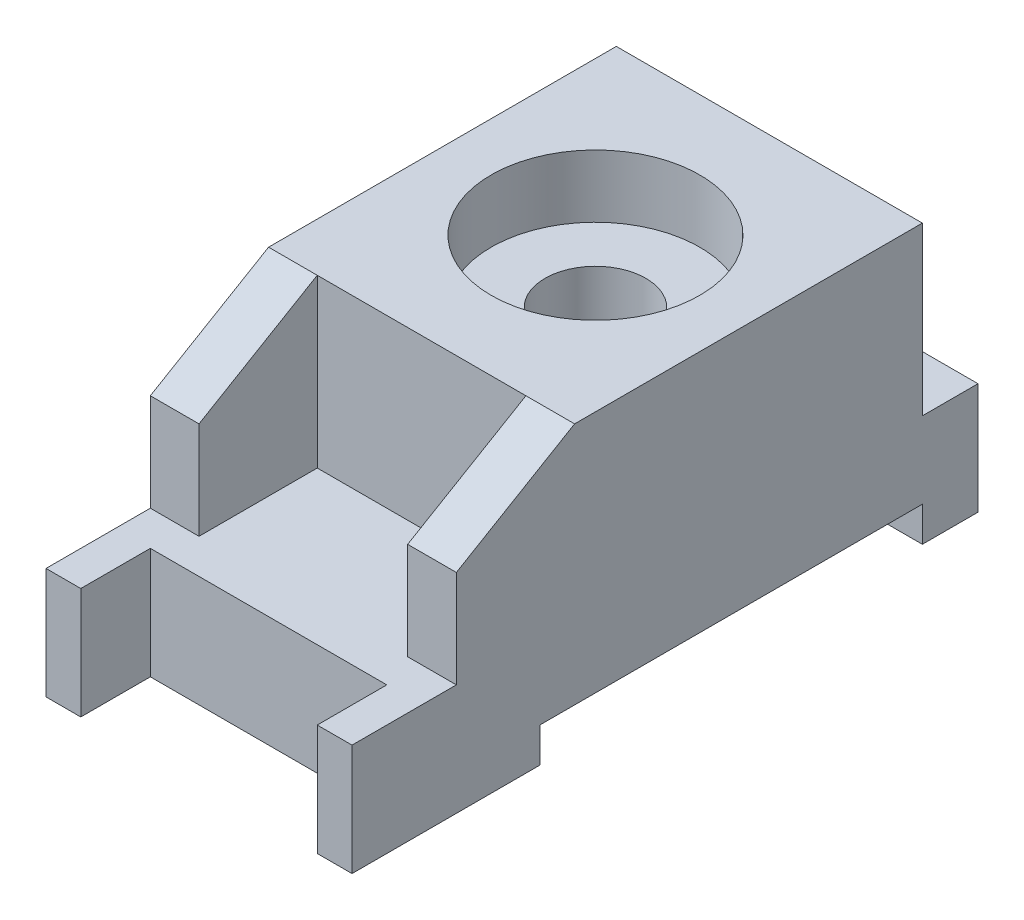
from build123d import *

# Parameters (mm, degrees)
SKETCH_1_W          = 44
SKETCH_1_H          = 16
EXTRUDE_1_DEPTH     = 90
SKETCH_2_W          = 55
SKETCH_2_H          = 5
CUT_EXTRUDE_1_DEPTH = 101.498756211
SKETCH_3_W          = 34
SKETCH_3_H          = 10
CUT_EXTRUDE_2_DEPTH = 95.021274188
SKETCH_4_W          = 44
SKETCH_4_H          = 67
EXTRUDE_2_DEPTH     = 24
SKETCH_5_W          = 30
SKETCH_5_H          = 17
CUT_EXTRUDE_3_DEPTH = 24
CUT_EXTRUDE_4_DEPTH = 106.166534601
SKETCH_7_R          = 15
CUT_EXTRUDE_5_DEPTH = 9
SKETCH_8_R          = 7.25
CUT_EXTRUDE_6_DEPTH = 98.698515854


with BuildPart() as part:
    # Эскиз1 → Бобышка-Вытянуть1 (new body)
    with BuildSketch(Plane.XY):
        Rectangle(SKETCH_1_W, SKETCH_1_H)
    extrude(amount=EXTRUDE_1_DEPTH)

    # Эскиз2 → Вырез-Вытянуть1 (cut, through all)
    with BuildSketch(Plane(origin=(22, 0, 0), x_dir=(0, 0, -1), z_dir=(1, 0, 0))):
        with Locations((-35.5, -5.5)):
            Rectangle(SKETCH_2_W, SKETCH_2_H)
    extrude(amount=-CUT_EXTRUDE_1_DEPTH, mode=Mode.SUBTRACT)

    # Эскиз3 → Вырез-Вытянуть2 (cut, through all)
    with BuildSketch(Plane(origin=(0, 8, 0), x_dir=(1, 0, 0), z_dir=(0, 1, 0))):
        with Locations((0, -85)):
            Rectangle(SKETCH_3_W, SKETCH_3_H)
    extrude(amount=-CUT_EXTRUDE_2_DEPTH, mode=Mode.SUBTRACT)

    # Эскиз4 → Бобышка-Вытянуть2 (add)
    with BuildSketch(Plane(origin=(0, 8, 0), x_dir=(1, 0, 0), z_dir=(0, 1, 0))):
        with Locations((0, -41.5)):
            Rectangle(SKETCH_4_W, SKETCH_4_H)
    extrude(amount=EXTRUDE_2_DEPTH)

    # Эскиз5 → Вырез-Вытянуть3 (cut)
    with BuildSketch(Plane(origin=(0, 32, 0), x_dir=(1, 0, 0), z_dir=(0, 1, 0))):
        with Locations((0, -66.5)):
            Rectangle(SKETCH_5_W, SKETCH_5_H)
    extrude(amount=-CUT_EXTRUDE_3_DEPTH, mode=Mode.SUBTRACT)

    # Эскиз6 → Вырез-Вытянуть4 (cut, through all)
    with BuildSketch(Plane(origin=(22, 0, 0), x_dir=(0, 0, -1), z_dir=(1, 0, 0))):
        Polygon((-75, 22), (-58, 32), (-75, 32), align=None)
    extrude(amount=-CUT_EXTRUDE_4_DEPTH, mode=Mode.SUBTRACT)

    # Эскиз7 → Вырез-Вытянуть5 (cut)
    with BuildSketch(Plane(origin=(0, 32, 0), x_dir=(1, 0, 0), z_dir=(0, 1, 0))):
        with Locations(Location((0, -33, 0), (0, 0, 270))):
            Circle(SKETCH_7_R)
    extrude(amount=-CUT_EXTRUDE_5_DEPTH, mode=Mode.SUBTRACT)

    # Эскиз8 → Вырез-Вытянуть6 (cut, through all)
    with BuildSketch(Plane(origin=(0, 23, 0), x_dir=(1, 0, 0), z_dir=(0, 1, 0))):
        with Locations(Location((0, -33, 0), (0, 0, 270))):
            Circle(SKETCH_8_R)
    extrude(amount=-CUT_EXTRUDE_6_DEPTH, mode=Mode.SUBTRACT)


solid = part.part
